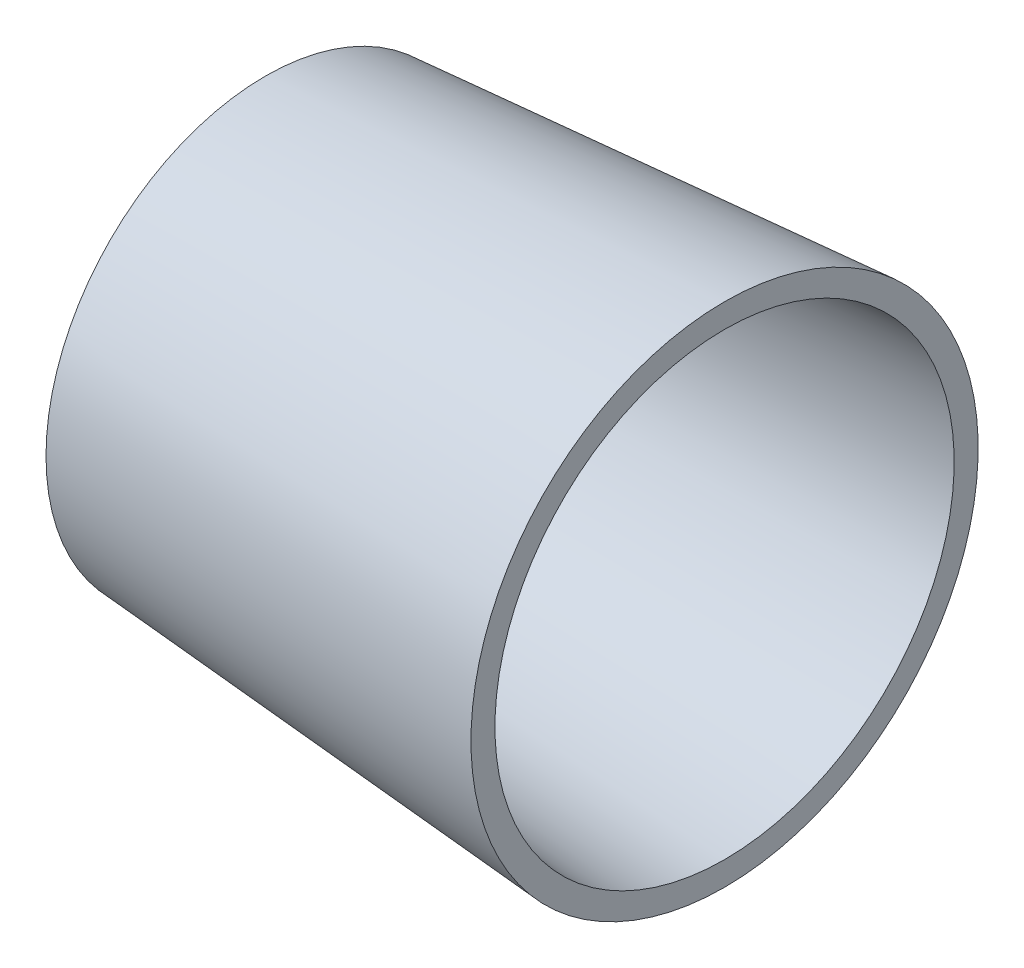
from build123d import *

# Parameters (mm, degrees)
REVOLVE1_ANGLE = 359.999999589


with BuildPart() as part:
    # Sketch1 → Revolve1 (revolve)
    with BuildSketch(Plane.XY):
        Polygon((4780, 580), (4780, 640), (6120, 740), (6120, 670), align=None)
    revolve(axis=Axis((0, 0, 0), (1, 0, 0)), revolution_arc=REVOLVE1_ANGLE)


solid = part.part
